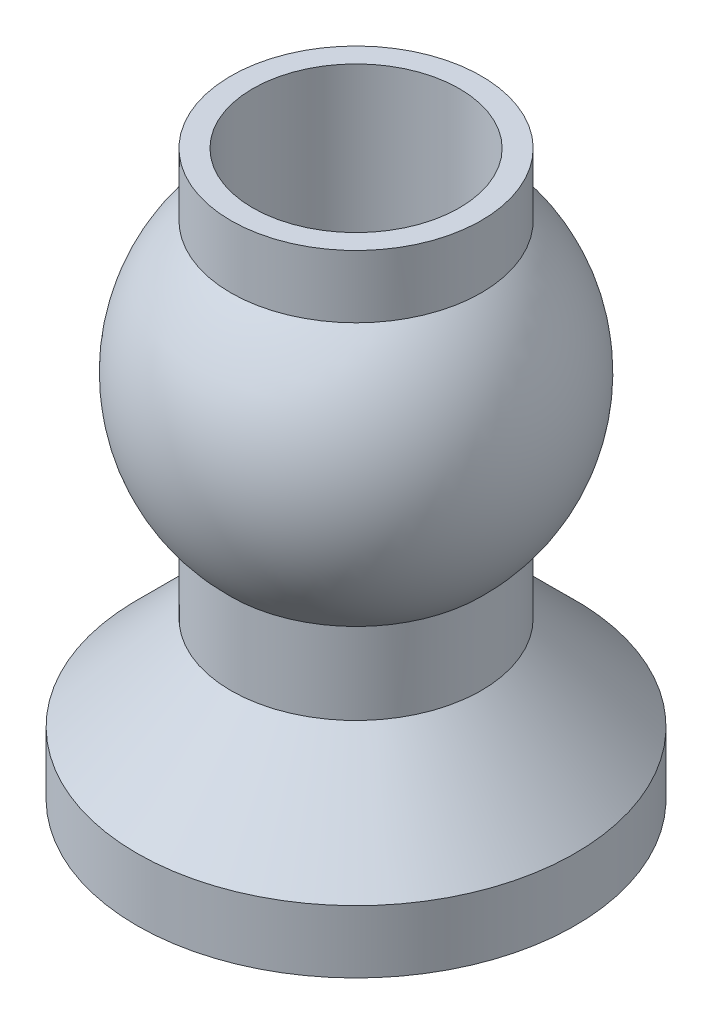
from build123d import *

# Parameters (mm, degrees)
SKETCH2_R          = 1.65
CUT_EXTRUDE1_DEPTH = 12.5


with BuildPart() as part:
    # Sketch1 → Revolve1 (revolve)
    with BuildSketch(Plane.XY, mode=Mode.PRIVATE) as revolve1_sk:
        with BuildLine():
            Line((0, 4.5), (0, -4.5))
            Line((0, -4.5), (3.5, -4.5))
            Line((3.5, -4.5), (3.5, -3.5))
            Line((3.5, -3.5), (2, -2))
            Line((2, -2), (2, -0.7))
            ThreePointArc((2, -0.7), (2.9, 1.4), (2, 3.5))
            Line((2, 3.5), (2, 4.5))
            Line((2, 4.5), (0, 4.5))
        make_face()
    revolve(revolve1_sk.sketch.rotate(Axis((0, 9.816629846, 0), (0, -1, 0)), 90), axis=Axis((0, 9.816629846, 0), (0, -1, 0)))

    # Sketch2 → Cut-Extrude1 (cut)
    with BuildSketch(Plane(origin=(0, 4.5, 0), x_dir=(1, 0, 0), z_dir=(0, 1, 0))):
        with Locations(Location((0, 0, 0), (0, 0, 270))):
            Circle(SKETCH2_R)
    extrude(amount=-CUT_EXTRUDE1_DEPTH, mode=Mode.SUBTRACT)


solid = part.part
